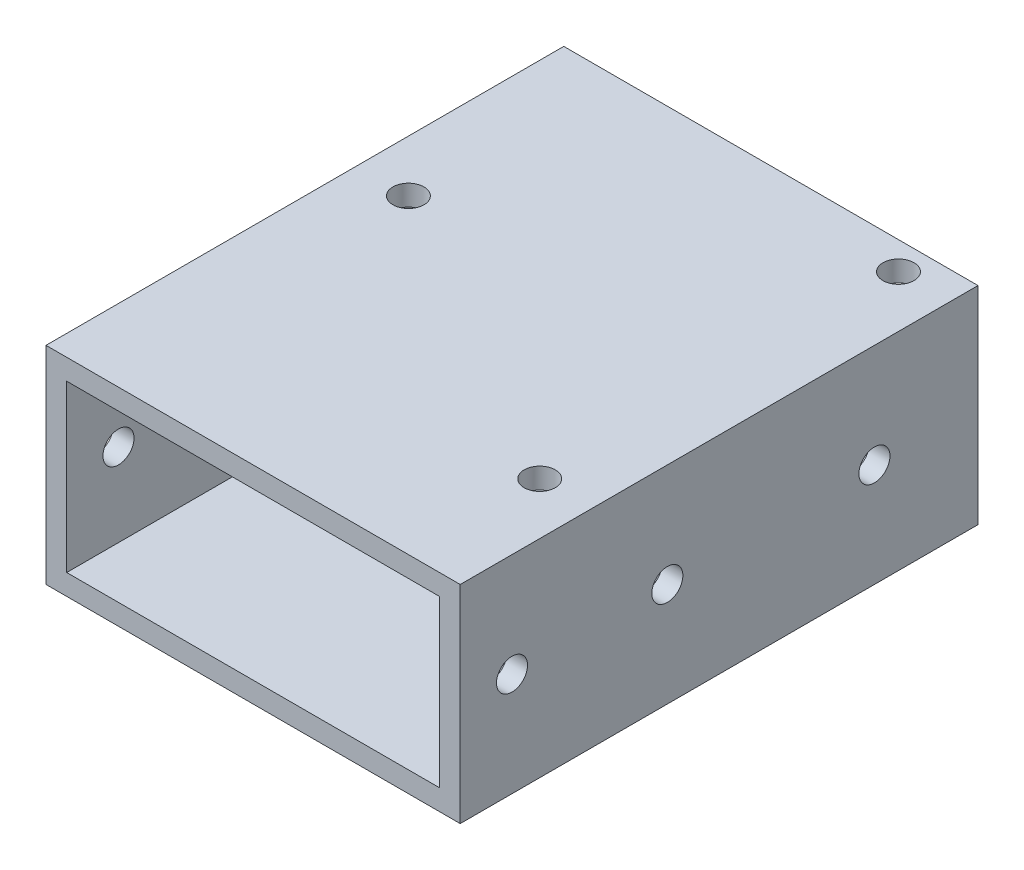
from build123d import *

# Parameters (mm, degrees)
SKETCH_1_W          = 40
SKETCH_1_H          = 20
SKETCH_1_W_2        = 36
SKETCH_1_H_2        = 16
EXTRUDE_1_DEPTH     = 50
SKETCH_2_R          = 1.5
CUT_EXTRUDE_1_DEPTH = 50
SKETCH_3_R          = 1.5
CUT_EXTRUDE_2_DEPTH = 50


with BuildPart() as part:
    # 草图1 → 凸台-拉伸1 (new body)
    with BuildSketch(Plane.XY):
        Rectangle(SKETCH_1_W, SKETCH_1_H)
        Rectangle(SKETCH_1_W_2, SKETCH_1_H_2, mode=Mode.SUBTRACT)
    extrude(amount=EXTRUDE_1_DEPTH)

    # 草图2 → 切除-拉伸1 (cut)
    with BuildSketch(Plane(origin=(0, 10, 0), x_dir=(1, 0, 0), z_dir=(0, 1, 0))):
        with Locations(Location((-15, -20, 0), (0, 0, 270))):
            Circle(SKETCH_2_R)
        with Locations(Location((15, -2.679491924, 0), (0, 0, 270))):
            Circle(SKETCH_2_R)
        with Locations(Location((15, -37.320508076, 0), (0, 0, 270))):
            Circle(SKETCH_2_R)
    extrude(amount=-CUT_EXTRUDE_1_DEPTH, mode=Mode.SUBTRACT)

    # 草图3 → 切除-拉伸2 (cut)
    with BuildSketch(Plane.ZY.offset(20)):
        with Locations(Location((10, 0, 0), (0, 0, 270))):
            Circle(SKETCH_3_R)
        with Locations(Location((30, 0, 0), (0, 0, 270))):
            Circle(SKETCH_3_R)
        with Locations(Location((45, 0, 0), (0, 0, 270))):
            Circle(SKETCH_3_R)
    extrude(amount=-CUT_EXTRUDE_2_DEPTH, mode=Mode.SUBTRACT)


solid = part.part
